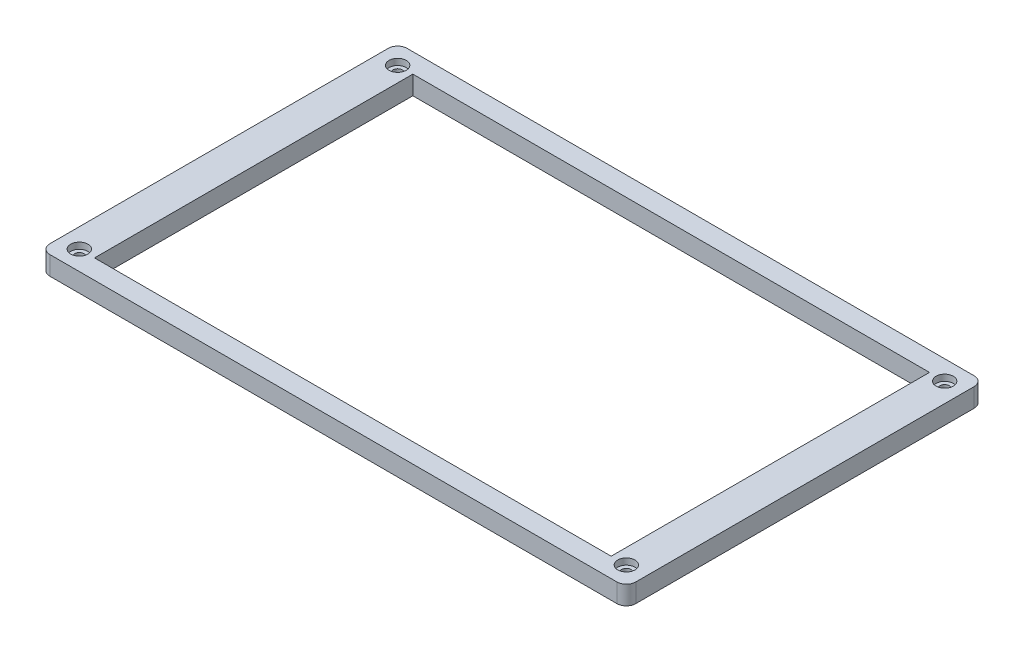
from build123d import *

# Parameters (mm, degrees)
SKETCH_1_W          = 187
SKETCH_1_H          = 114
EXTRUDE_1_DEPTH     = 6
FILLET_1_R          = 3
SKETCH_3_W          = 164.9
SKETCH_3_H          = 101.6
CUT_EXTRUDE_1_DEPTH = 6
SKETCH_6_R          = 1.5
CUT_EXTRUDE_3_DEPTH = 6
SKETCH_7_R          = 2.75
CUT_EXTRUDE_4_DEPTH = 2


with BuildPart() as part:
    # 草图1 → 凸台-拉伸1 (new body)
    with BuildSketch(Plane(origin=(0, 0, 0), x_dir=(1, 0, 0), z_dir=(0, 1, 0))):
        with Locations((0.200214133, 4.065310493)):
            Rectangle(SKETCH_1_W, SKETCH_1_H)
    extrude(amount=EXTRUDE_1_DEPTH)

    # 圆角1
    fillet_1_edges = [part.edges().sort_by_distance(p)[0] for p in [
        (-93.299785867, 3, -61.065310493),
        (93.700214133, 3, -61.065310493),
        (93.700214133, 3, 52.934689507),
        (-93.299785867, 3, 52.934689507),
    ]]
    fillet(fillet_1_edges, radius=FILLET_1_R)

    # 草图3 → 切除-拉伸1 (cut)
    with BuildSketch(Plane(origin=(0, 6, 0), x_dir=(1, 0, 0), z_dir=(0, 1, 0))):
        with Locations((0.200562113, 4.065310493)):
            Rectangle(SKETCH_3_W, SKETCH_3_H)
    extrude(amount=-CUT_EXTRUDE_1_DEPTH, mode=Mode.SUBTRACT)

    # 草图6 → 切除-拉伸3 (cut)
    with BuildSketch(Plane(origin=(0, 6, 0), x_dir=(1, 0, 0), z_dir=(0, 1, 0))):
        with Locations(Location((87.500562113, -46.734892708, 0), (0, 0, 270))):
            Circle(SKETCH_6_R)
        with Locations(Location((87.500562113, 54.865513693, 0), (0, 0, 90))):
            Circle(SKETCH_6_R)
        with Locations(Location((-87.100133848, -46.734892708, 0), (0, 0, 90))):
            Circle(SKETCH_6_R)
        with Locations(Location((-87.100133848, 54.865513693, 0), (0, 0, 270))):
            Circle(SKETCH_6_R)
    extrude(amount=-CUT_EXTRUDE_3_DEPTH, mode=Mode.SUBTRACT)

    # 草图7 → 切除-拉伸4 (cut)
    with BuildSketch(Plane(origin=(0, 6, 0), x_dir=(1, 0, 0), z_dir=(0, 1, 0))):
        with Locations(Location((-87.099785867, 54.865310493, 0), (0, 0, 270))):
            Circle(SKETCH_7_R)
        with Locations(Location((87.500214133, 54.865310493, 0), (0, 0, 90))):
            Circle(SKETCH_7_R)
        with Locations(Location((-87.099785867, -46.734689507, 0), (0, 0, 90))):
            Circle(SKETCH_7_R)
        with Locations(Location((87.500214133, -46.734689507, 0), (0, 0, 270))):
            Circle(SKETCH_7_R)
    extrude(amount=-CUT_EXTRUDE_4_DEPTH, mode=Mode.SUBTRACT)


solid = part.part
